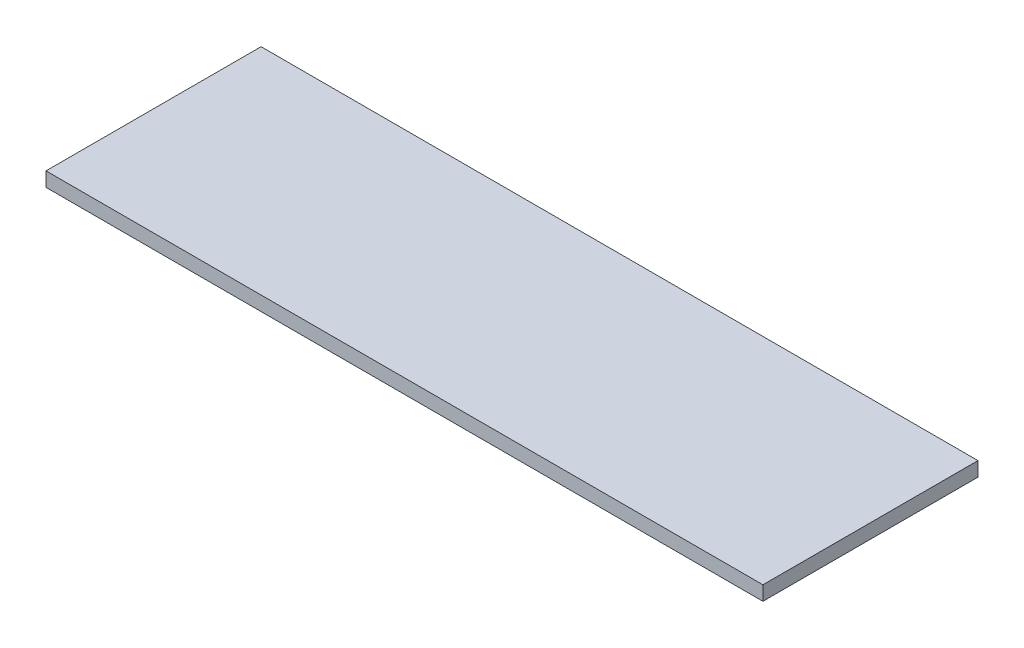
from build123d import *

# Parameters (mm, degrees)
BOSS_EXTRUDE1_DEPTH     = 5
BOSS_EXTRUDE2_DEPTH     = 50
CUT_EXTRUDE1_DEPTH      = 64.348243859
CUT_EXTRUDE1_DEPTH_BACK = 64.348243859
SKETCH2_R               = 1.5


with BuildPart() as part:
    # Sketch1 → Boss-Extrude1 (new, symmetric)
    with BuildSketch(Plane(origin=(0, 0, 0), x_dir=(0, 0, -1), z_dir=(1, 0, 0))):
        Polygon((-2, 0), (0, 0), (0, 25), (2, 25), (2, 27), (-28, 27), (-28, 25), (-2, 25), align=None)
    extrude(amount=BOSS_EXTRUDE1_DEPTH, both=True)

    # Sketch1<3> → Boss-Extrude2 (add, symmetric)
    with BuildSketch(Plane(origin=(0, 0, 0), x_dir=(0, 0, -1), z_dir=(1, 0, 0))):
        Polygon((-2, 25), (0, 25), (2, 25), (2, 27), (-28, 27), (-28, 25), align=None)
    extrude(amount=BOSS_EXTRUDE2_DEPTH, both=True)

    # Sketch2 → Cut-Extrude1 (cut, two sides: drawn at the far end of the back side and taken through both)
    with BuildSketch(Plane(origin=(0, 0, 0), x_dir=(-1, 0, 0), z_dir=(0, 0, -1)).offset(-CUT_EXTRUDE1_DEPTH_BACK)):
        with Locations((0, 5)):
            Circle(SKETCH2_R)
    extrude(amount=CUT_EXTRUDE1_DEPTH + CUT_EXTRUDE1_DEPTH_BACK, mode=Mode.SUBTRACT)


solid = part.part
